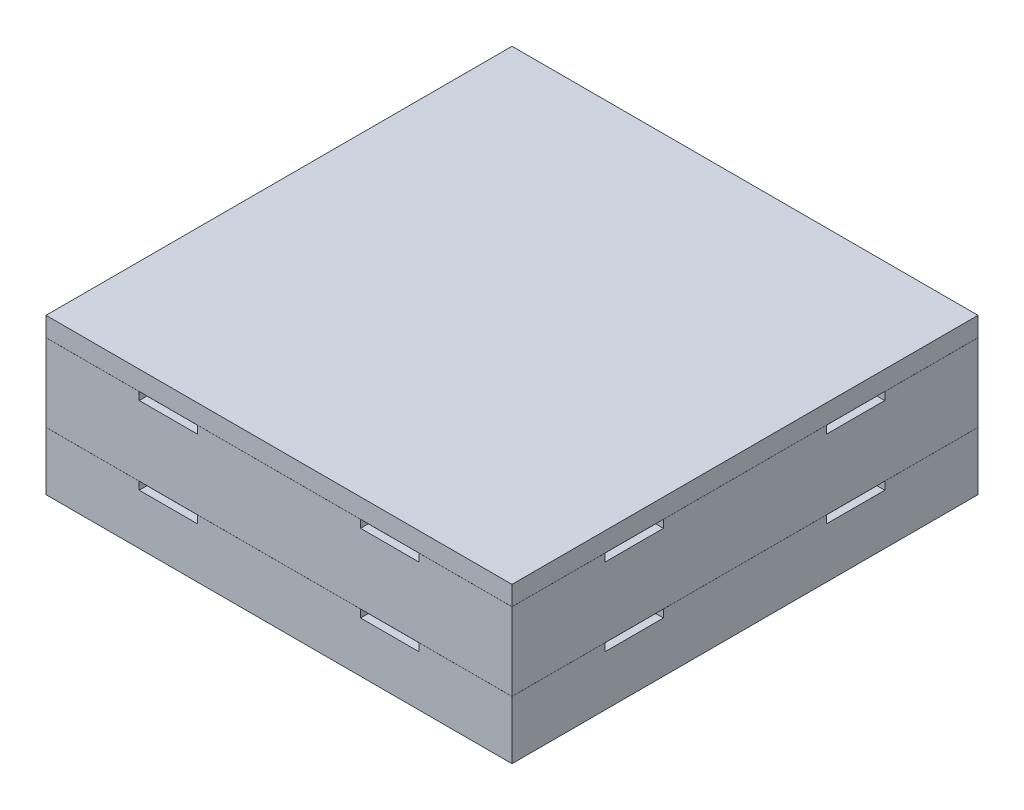
from build123d import *

# Parameters (mm, degrees)
SKETCH_1_W             = 600
SKETCH_1_H             = 600
EXTRUDE_1_DEPTH        = 400
CUT_EXTRUDE_1_DEPTH    = 20
CUT_EXTRUDE_2_DEPTH    = 20
PATTERN_LINEAR_1_COUNT = 2
PATTERN_LINEAR_1_PITCH = 200


with BuildPart() as part:
    # 草图1 → 凸台-拉伸1 (new body)
    with BuildSketch(Plane(origin=(0, 0, 0), x_dir=(1, 0, 0), z_dir=(0, 1, 0))):
        with Locations((-300, -300)):
            Rectangle(SKETCH_1_W, SKETCH_1_H)
    extrude(amount=EXTRUDE_1_DEPTH)

    # 草图2 → 切除-拉伸1 (cut)
    with BuildSketch(Plane.ZY.offset(600)):
        Polygon((600, 150.2), (0, 150.2), (0, 150), (210, 150), (210, 130), (360, 130), (360, 150), (600, 150), align=None)
    cut_extrude_1 = extrude(amount=-CUT_EXTRUDE_1_DEPTH, mode=Mode.SUBTRACT)

    # 草图3 → 切除-拉伸2 (cut)
    with BuildSketch(Plane.XY.offset(600)):
        Polygon((-580, 150.2), (-580, 150), (-360, 150), (-360, 130), (-210, 130), (-210, 150), (0, 150), (0, 150.2), align=None)
    cut_extrude_2 = extrude(amount=-CUT_EXTRUDE_2_DEPTH, mode=Mode.SUBTRACT)

    # 阵列(线性)1: 切除-拉伸1, 切除-拉伸2 ×2
    with Locations(*[(0, i * PATTERN_LINEAR_1_PITCH, 0) for i in range(1, PATTERN_LINEAR_1_COUNT)]):
        add(cut_extrude_1, mode=Mode.SUBTRACT)
        add(cut_extrude_2, mode=Mode.SUBTRACT)

    # 镜向1: part across plane


with BuildPart() as part_1:
    add(part.part)
    add(part.part.mirror(Plane(origin=(0, 400, 0), x_dir=(1, 0, 0), z_dir=(0, 0, 1))))

    # 镜向2: part across plane


with BuildPart() as part_2:
    add(part_1.part)
    add(part_1.part.mirror(Plane(origin=(0, 400, 0), x_dir=(0, 0, 1), z_dir=(-1, 0, 0))))


solid = part_2.part
